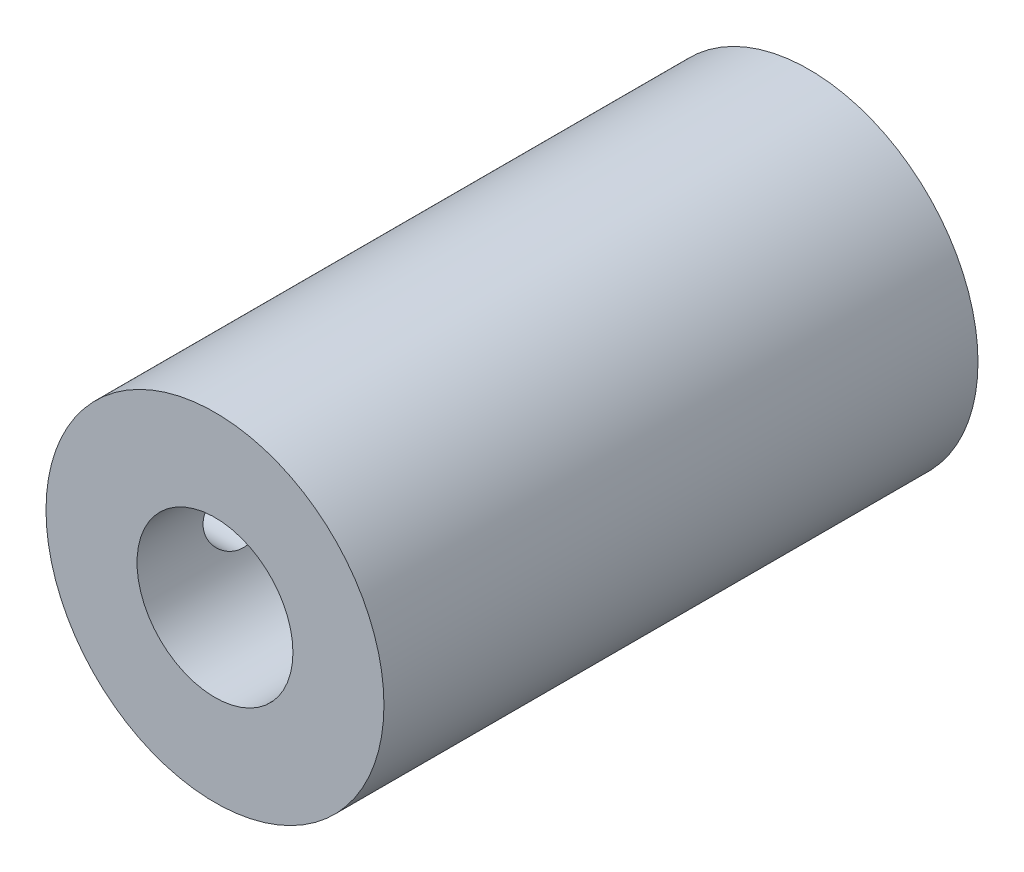
from build123d import *

# Parameters (mm, degrees)
SKETCH2_R               = 32.512
SKETCH2_R_2             = 15
BOSS_EXTRUDE1_DEPTH     = 57.15
CUT_EXTRUDE1_REACH      = 75.35
CUT_EXTRUDE1_END_RADIUS = 32.512
SKETCH3_R               = 6.35
CUT_EXTRUDE2_REACH      = 75.35
CUT_EXTRUDE2_END_RADIUS = 32.512
SKETCH5_R               = 3.5


with BuildPart() as part:
    # Sketch2 → Boss-Extrude1 (new, symmetric)
    with BuildSketch(Plane.XY):
        Circle(SKETCH2_R)
        Circle(SKETCH2_R_2, mode=Mode.SUBTRACT)
    extrude(amount=BOSS_EXTRUDE1_DEPTH, both=True)

    # Cut-Extrude1: up to this cylinder (the profile starts inside it)
    cut_extrude1_end = Plane(origin=(0, 0, 38.1), z_dir=(0, 0, -1)) * Cylinder(CUT_EXTRUDE1_END_RADIUS, 216.724, mode=Mode.PRIVATE)
    # Sketch3 → Cut-Extrude1 (cut, up to the surface)
    with BuildSketch(Plane(origin=(0, 0, 0), x_dir=(0, 0, -1), z_dir=(1, 0, 0)), mode=Mode.PRIVATE) as cut_extrude1_sk1:
        with Locations((-38.1, 0)):
            Circle(SKETCH3_R)
    cut_extrude1_tool1 = extrude(cut_extrude1_sk1.sketch, amount=-CUT_EXTRUDE1_REACH, mode=Mode.PRIVATE) & cut_extrude1_end
    add(cut_extrude1_tool1.solids().sort_by_distance((0, 0, 38.1))[0], mode=Mode.SUBTRACT)

    # Cut-Extrude2: up to this cylinder (the profile starts inside it)
    cut_extrude2_end = Plane(origin=(0, 0, 0), z_dir=(0, 0, -1)) * Cylinder(CUT_EXTRUDE2_END_RADIUS, 216.724, mode=Mode.PRIVATE)
    # Sketch5 → Cut-Extrude2 (cut, up to the surface)
    with BuildSketch(Plane(origin=(0, 0, 0), x_dir=(1, 0, 0), z_dir=(0, 1, 0)), mode=Mode.PRIVATE) as cut_extrude2_sk1:
        with Locations(Location((0, 0, 0), (0, 0, 270))):
            Circle(SKETCH5_R)
    cut_extrude2_tool1 = extrude(cut_extrude2_sk1.sketch, amount=-CUT_EXTRUDE2_REACH, mode=Mode.PRIVATE) & cut_extrude2_end
    add(cut_extrude2_tool1.solids().sort_by_distance((0, 0, 0))[0], mode=Mode.SUBTRACT)


solid = part.part
